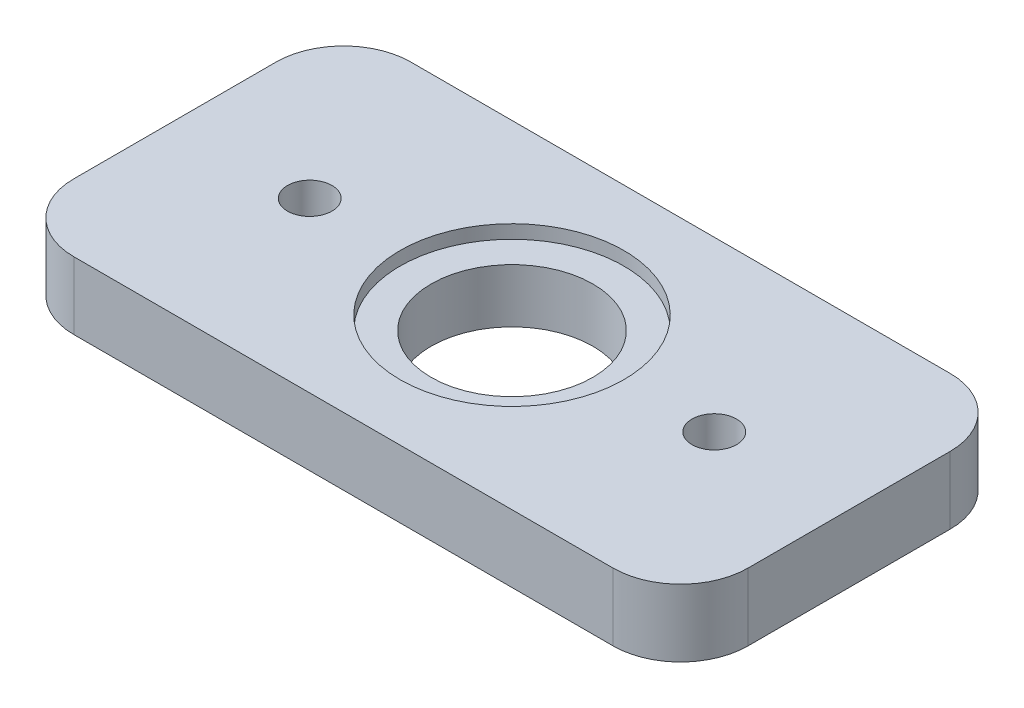
from build123d import *

# Parameters (mm, degrees)
SKETCH_1_W          = 50
SKETCH_1_H          = 25
EXTRUDE_1_DEPTH     = 5
SKETCH_2_R          = 6
SKETCH_2_R_2        = 1.65
CUT_EXTRUDE_1_DEPTH = 5
SKETCH_4_R          = 8.3
CUT_EXTRUDE_2_DEPTH = 1
FILLET_1_R          = 5


with BuildPart() as part:
    # 草图1 → 凸台-拉伸1 (new body)
    with BuildSketch(Plane(origin=(0, 0, 0), x_dir=(1, 0, 0), z_dir=(0, 1, 0))):
        with Locations((25, 12.5)):
            Rectangle(SKETCH_1_W, SKETCH_1_H)
    extrude(amount=EXTRUDE_1_DEPTH)

    # 草图2 → 切除-拉伸1 (cut)
    with BuildSketch(Plane(origin=(0, 5, 0), x_dir=(1, 0, 0), z_dir=(0, 1, 0))):
        with Locations(Location((25, 12.5, 0), (0, 0, 270))):
            Circle(SKETCH_2_R)
        with Locations(Location((40, 12.5, 0), (0, 0, 270))):
            Circle(SKETCH_2_R_2)
        with Locations(Location((10, 12.5, 0), (0, 0, 270))):
            Circle(SKETCH_2_R_2)
    extrude(amount=-CUT_EXTRUDE_1_DEPTH, mode=Mode.SUBTRACT)

    # 草图4 → 切除-拉伸2 (cut)
    with BuildSketch(Plane(origin=(0, 5, 0), x_dir=(1, 0, 0), z_dir=(0, 1, 0))):
        with Locations(Location((25, 12.5, 0), (0, 0, 270))):
            Circle(SKETCH_4_R)
    extrude(amount=-CUT_EXTRUDE_2_DEPTH, mode=Mode.SUBTRACT)

    # 圆角1
    fillet_1_edges = [part.edges().sort_by_distance(p)[0] for p in [
        (0, 2.5, -25),
        (50, 2.5, -25),
        (50, 2.5, 0),
        (0, 2.5, 0),
    ]]
    fillet(fillet_1_edges, radius=FILLET_1_R)


solid = part.part
